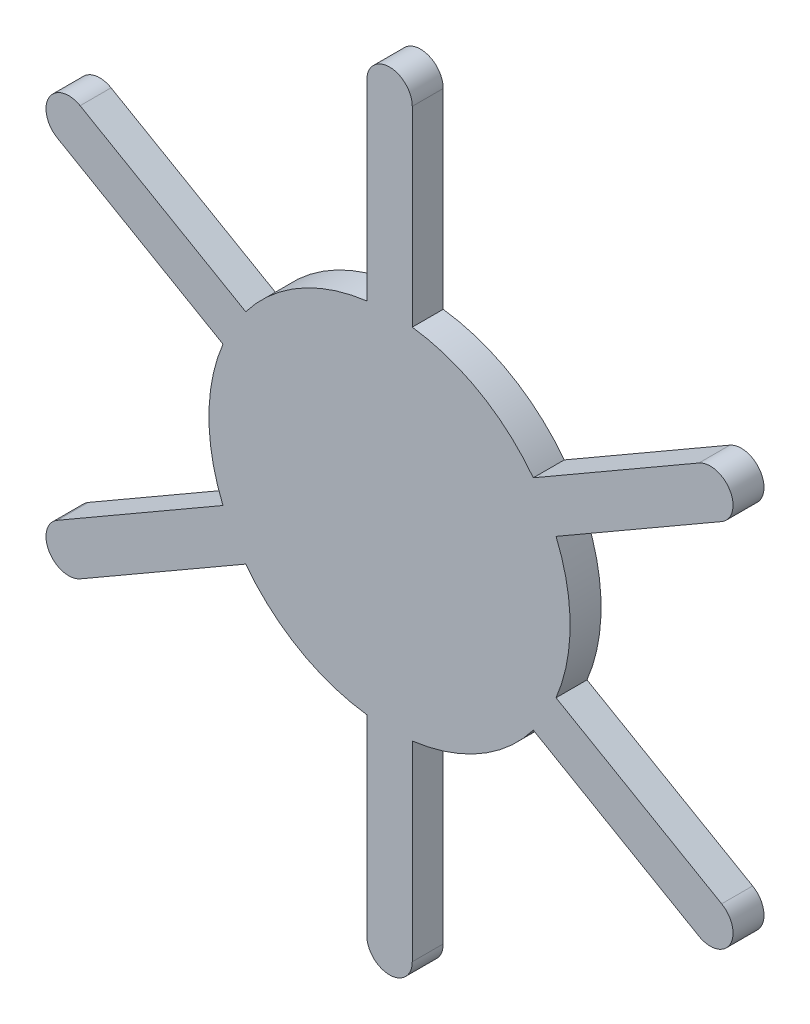
from build123d import *

# Parameters (mm, degrees)
BOSS_EXTRUDE1_DEPTH = 15


with BuildPart() as part:
    # Sketch1 → Boss-Extrude1 (new, symmetric)
    with BuildSketch(Plane.XY):
        with BuildLine():
            Line((-299.814682012, 198.540409756), (-139.331537098, 105.88542284))
            ThreePointArc((-139.331537098, 105.88542284), (-87.5, 151.554445662), (-22.033697521, 173.607362095))
            Line((-22.033697521, 173.607362095), (-22.033697521, 358.917335928))
            ThreePointArc((-22.033697521, 358.917335928), (0, 380.951033449), (22.033697521, 358.917335928))
            Line((22.033697521, 358.917335928), (22.033697521, 173.607362095))
            ThreePointArc((22.033697521, 173.607362095), (87.5, 151.554445662), (139.331537098, 105.88542284))
            Line((139.331537098, 105.88542284), (299.814682012, 198.540409756))
            ThreePointArc((299.814682012, 198.540409756), (329.913272565, 190.475516725), (321.848379533, 160.376926172))
            Line((321.848379533, 160.376926172), (161.365234619, 67.721939255))
            ThreePointArc((161.365234619, 67.721939255), (175, 0), (161.365234619, -67.721939255))
            Line((161.365234619, -67.721939255), (321.848379533, -160.376926172))
            ThreePointArc((321.848379533, -160.376926172), (329.913272565, -190.475516725), (299.814682012, -198.540409756))
            Line((299.814682012, -198.540409756), (139.331537098, -105.88542284))
            ThreePointArc((139.331537098, -105.88542284), (87.5, -151.554445662), (22.033697521, -173.607362095))
            Line((22.033697521, -173.607362095), (22.033697521, -358.917335928))
            ThreePointArc((22.033697521, -358.917335928), (0, -380.951033449), (-22.033697521, -358.917335928))
            Line((-22.033697521, -358.917335928), (-22.033697521, -173.607362095))
            ThreePointArc((-22.033697521, -173.607362095), (-87.5, -151.554445662), (-139.331537098, -105.88542284))
            Line((-139.331537098, -105.88542284), (-299.814682012, -198.540409756))
            ThreePointArc((-299.814682012, -198.540409756), (-329.913272565, -190.475516725), (-321.848379533, -160.376926172))
            Line((-321.848379533, -160.376926172), (-161.365234619, -67.721939255))
            ThreePointArc((-161.365234619, -67.721939255), (-175, 0), (-161.365234619, 67.721939255))
            Line((-161.365234619, 67.721939255), (-321.848379533, 160.376926172))
            ThreePointArc((-321.848379533, 160.376926172), (-329.913272565, 190.475516725), (-299.814682012, 198.540409756))
        make_face()
    extrude(amount=BOSS_EXTRUDE1_DEPTH, both=True)


solid = part.part
